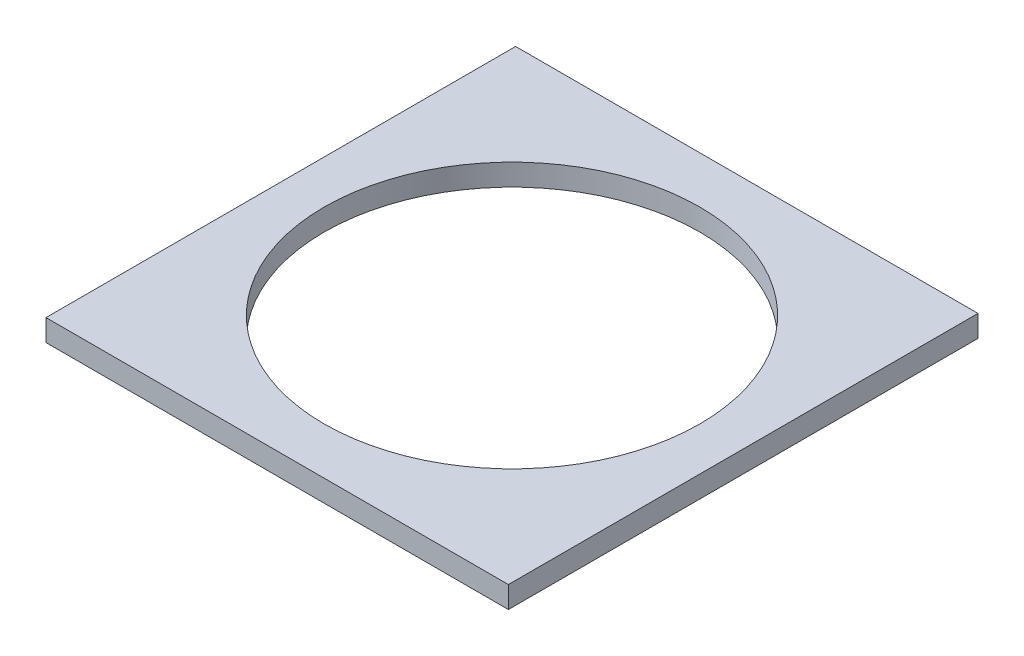
from build123d import *

# Parameters (mm, degrees)
SKETCH2_W           = 63.999951571
SKETCH2_H           = 64.999950779
SKETCH2_R           = 26
BOSS_EXTRUDE1_DEPTH = 3


with BuildPart() as part:
    # Sketch2 → Boss-Extrude1 (new body)
    with BuildSketch(Plane(origin=(0, 0, 0), x_dir=(1, 0, 0), z_dir=(0, 1, 0))):
        with Locations((-2.4214e-05, 2.461e-05)):
            Rectangle(SKETCH2_W, SKETCH2_H)
        with Locations(Location((0, 0, 0), (0, 0, 270))):
            Circle(SKETCH2_R, mode=Mode.SUBTRACT)
    extrude(amount=BOSS_EXTRUDE1_DEPTH)


solid = part.part
